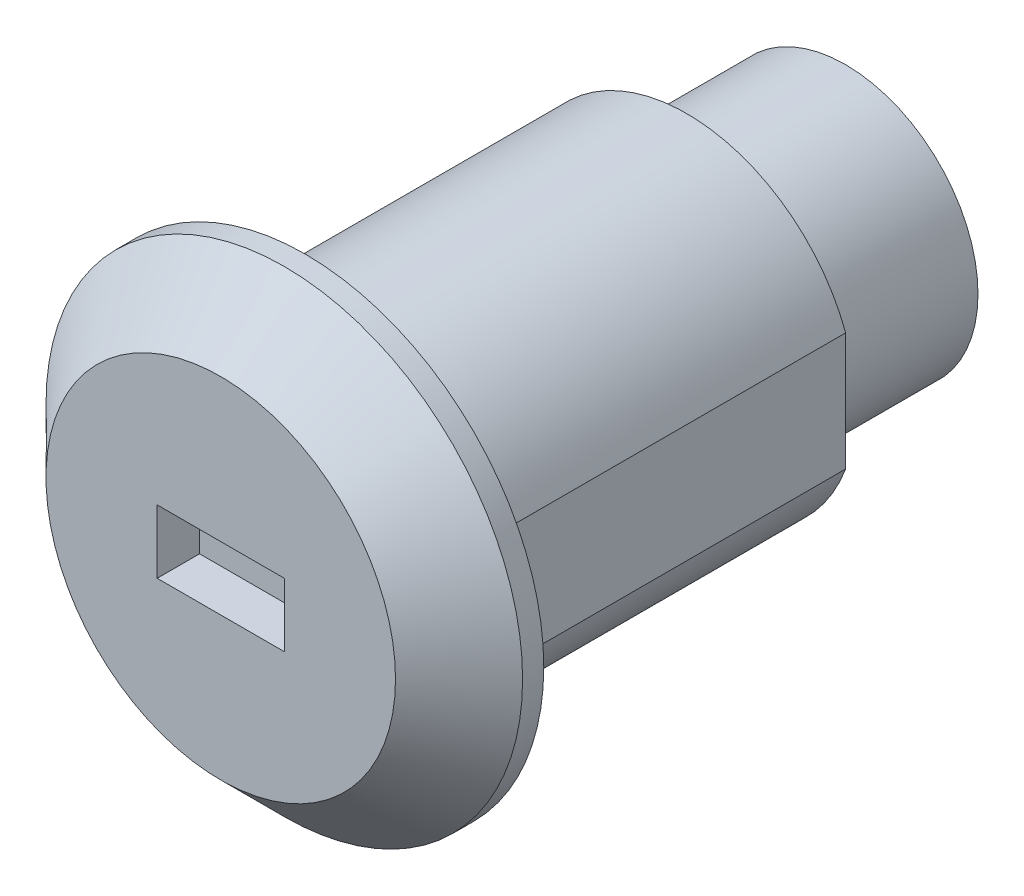
from build123d import *

# Parameters (mm, degrees)
SKETCH_1_R          = 11.25
EXTRUDE_1_DEPTH     = 4
CHAMFER_1_SIZE      = 3
SKETCH_2_W          = 6
SKETCH_2_H          = 3
CUT_EXTRUDE_1_DEPTH = 2
EXTRUDE_2_DEPTH     = 18
SKETCH_4_R          = 6.25
EXTRUDE_3_DEPTH     = 7.5


with BuildPart() as part:
    # 草图1 → 拉伸1 (new body)
    with BuildSketch(Plane.XY):
        Circle(SKETCH_1_R)
    extrude(amount=EXTRUDE_1_DEPTH)

    # 倒角1
    chamfer_1_edges = [part.edges().sort_by_distance(p)[0] for p in [
        (-11.25, 0, 4),
    ]]
    chamfer(chamfer_1_edges, length=CHAMFER_1_SIZE)

    # 草图2 → 切除-拉伸1 (cut)
    with BuildSketch(Plane.XY.offset(4)):
        Rectangle(SKETCH_2_W, SKETCH_2_H)
    extrude(amount=-CUT_EXTRUDE_1_DEPTH, mode=Mode.SUBTRACT)

    # 草图3 → 拉伸2 (add)
    with BuildSketch(Plane(origin=(0, 0, 0), x_dir=(-1, 0, 0), z_dir=(0, 0, -1))):
        with BuildLine():
            Line((-7.5, 2.783882181), (-7.5, -2.783882181))
            ThreePointArc((-7.5, -2.783882181), (0, -8), (7.5, -2.783882181))
            Line((7.5, -2.783882181), (7.5, 2.783882181))
            ThreePointArc((7.5, 2.783882181), (0, 8), (-7.5, 2.783882181))
        make_face()
    extrude(amount=EXTRUDE_2_DEPTH)

    # 草图4 → 拉伸3 (add)
    with BuildSketch(Plane(origin=(0, 0, -18), x_dir=(-1, 0, 0), z_dir=(0, 0, -1))):
        with Locations(Location((0, 0, 0), (0, 0, 180))):
            Circle(SKETCH_4_R)
    extrude(amount=EXTRUDE_3_DEPTH)


solid = part.part
